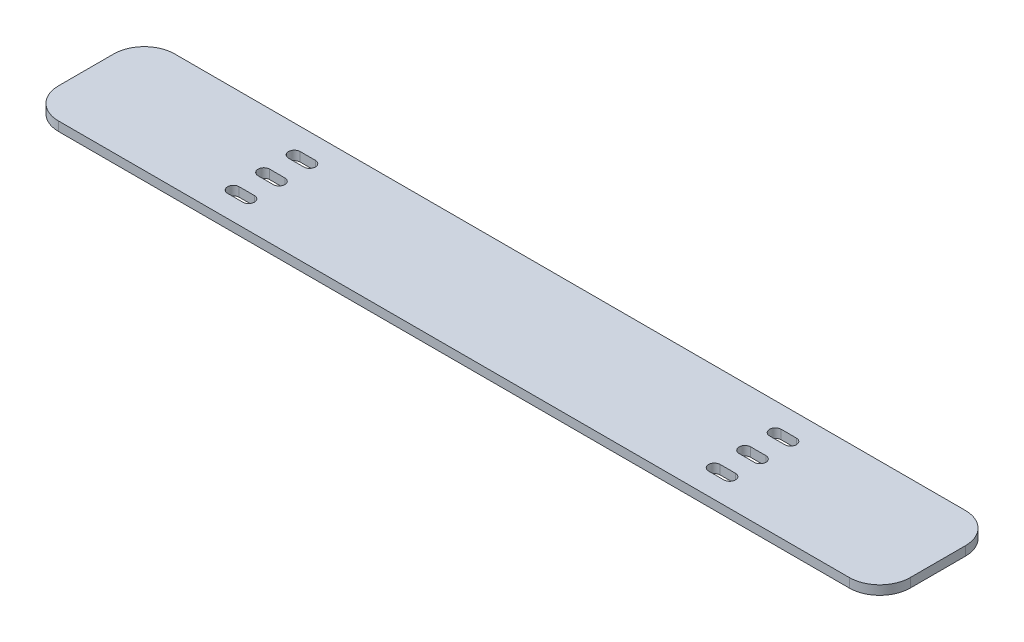
from build123d import *

# Parameters (mm, degrees)
BOSS_EXTRUDE1_DEPTH = 3
CUT_EXTRUDE1_REACH  = 284.002


with BuildPart() as part:
    # Sketch1 → Boss-Extrude1 (new body)
    with BuildSketch(Plane(origin=(0, 0, 0), x_dir=(1, 0, 0), z_dir=(0, 1, 0))):
        with BuildLine():
            Line((10, 0), (269.4, 0))
            ThreePointArc((269.4, 0), (276.471067812, -2.928932188), (279.4, -10))
            Line((279.4, -10), (279.4, -28.1))
            ThreePointArc((279.4, -28.1), (276.471067812, -35.171067812), (269.4, -38.1))
            Line((269.4, -38.1), (10, -38.1))
            ThreePointArc((10, -38.1), (2.928932188, -35.171067812), (0, -28.1))
            Line((0, -28.1), (0, -10))
            ThreePointArc((0, -10), (2.928932188, -2.928932188), (10, 0))
        make_face()
    extrude(amount=BOSS_EXTRUDE1_DEPTH)

    # Sketch2 → Cut-Extrude1 (cut, up to next)
    with BuildSketch(Plane(origin=(0, 3, 0), x_dir=(1, 0, 0), z_dir=(0, 1, 0)), mode=Mode.PRIVATE) as cut_extrude1_sk1:
        with BuildLine():
            Line((58.3, -17.15), (63.3, -17.15))
            ThreePointArc((63.3, -17.15), (65.2, -19.05), (63.3, -20.95))
            Line((63.3, -20.95), (58.3, -20.95))
            ThreePointArc((58.3, -20.95), (56.4, -19.05), (58.3, -17.15))
        make_face()
    cut_extrude1_tool1 = extrude(cut_extrude1_sk1.sketch, amount=-CUT_EXTRUDE1_REACH, mode=Mode.PRIVATE) & part.part
    # Sketch2 → Cut-Extrude1 (cut, up to next)
    with BuildSketch(Plane(origin=(0, 3, 0), x_dir=(1, 0, 0), z_dir=(0, 1, 0)), mode=Mode.PRIVATE) as cut_extrude1_sk2:
        with BuildLine():
            Line((221.1, -17.15), (216.1, -17.15))
            ThreePointArc((216.1, -17.15), (214.2, -19.05), (216.1, -20.95))
            Line((216.1, -20.95), (221.1, -20.95))
            ThreePointArc((221.1, -20.95), (223, -19.05), (221.1, -17.15))
        make_face()
    cut_extrude1_tool2 = extrude(cut_extrude1_sk2.sketch, amount=-CUT_EXTRUDE1_REACH, mode=Mode.PRIVATE) & part.part
    # Sketch2 → Cut-Extrude1 (cut, up to next)
    with BuildSketch(Plane(origin=(0, 3, 0), x_dir=(1, 0, 0), z_dir=(0, 1, 0)), mode=Mode.PRIVATE) as cut_extrude1_sk3:
        with BuildLine():
            Line((221.1, -27.15), (216.1, -27.15))
            ThreePointArc((216.1, -27.15), (214.2, -29.05), (216.1, -30.95))
            Line((216.1, -30.95), (221.1, -30.95))
            ThreePointArc((221.1, -30.95), (223, -29.05), (221.1, -27.15))
        make_face()
    cut_extrude1_tool3 = extrude(cut_extrude1_sk3.sketch, amount=-CUT_EXTRUDE1_REACH, mode=Mode.PRIVATE) & part.part
    # Sketch2 → Cut-Extrude1 (cut, up to next)
    with BuildSketch(Plane(origin=(0, 3, 0), x_dir=(1, 0, 0), z_dir=(0, 1, 0)), mode=Mode.PRIVATE) as cut_extrude1_sk4:
        with BuildLine():
            Line((221.1, -7.15), (216.1, -7.15))
            ThreePointArc((216.1, -7.15), (214.2, -9.05), (216.1, -10.95))
            Line((216.1, -10.95), (221.1, -10.95))
            ThreePointArc((221.1, -10.95), (223, -9.05), (221.1, -7.15))
        make_face()
    cut_extrude1_tool4 = extrude(cut_extrude1_sk4.sketch, amount=-CUT_EXTRUDE1_REACH, mode=Mode.PRIVATE) & part.part
    # Sketch2 → Cut-Extrude1 (cut, up to next)
    with BuildSketch(Plane(origin=(0, 3, 0), x_dir=(1, 0, 0), z_dir=(0, 1, 0)), mode=Mode.PRIVATE) as cut_extrude1_sk5:
        with BuildLine():
            Line((58.3, -27.15), (63.3, -27.15))
            ThreePointArc((63.3, -27.15), (65.2, -29.05), (63.3, -30.95))
            Line((63.3, -30.95), (58.3, -30.95))
            ThreePointArc((58.3, -30.95), (56.4, -29.05), (58.3, -27.15))
        make_face()
    cut_extrude1_tool5 = extrude(cut_extrude1_sk5.sketch, amount=-CUT_EXTRUDE1_REACH, mode=Mode.PRIVATE) & part.part
    # Sketch2 → Cut-Extrude1 (cut, up to next)
    with BuildSketch(Plane(origin=(0, 3, 0), x_dir=(1, 0, 0), z_dir=(0, 1, 0)), mode=Mode.PRIVATE) as cut_extrude1_sk6:
        with BuildLine():
            Line((58.3, -7.15), (63.3, -7.15))
            ThreePointArc((63.3, -7.15), (65.2, -9.05), (63.3, -10.95))
            Line((63.3, -10.95), (58.3, -10.95))
            ThreePointArc((58.3, -10.95), (56.4, -9.05), (58.3, -7.15))
        make_face()
    cut_extrude1_tool6 = extrude(cut_extrude1_sk6.sketch, amount=-CUT_EXTRUDE1_REACH, mode=Mode.PRIVATE) & part.part
    add(cut_extrude1_tool1.solids().sort_by_distance((60.8, 3, 19.05))[0], mode=Mode.SUBTRACT)
    add(cut_extrude1_tool2.solids().sort_by_distance((218.6, 3, 19.05))[0], mode=Mode.SUBTRACT)
    add(cut_extrude1_tool3.solids().sort_by_distance((218.6, 3, 29.05))[0], mode=Mode.SUBTRACT)
    add(cut_extrude1_tool4.solids().sort_by_distance((218.6, 3, 9.05))[0], mode=Mode.SUBTRACT)
    add(cut_extrude1_tool5.solids().sort_by_distance((60.8, 3, 29.05))[0], mode=Mode.SUBTRACT)
    add(cut_extrude1_tool6.solids().sort_by_distance((60.8, 3, 9.05))[0], mode=Mode.SUBTRACT)


solid = part.part
